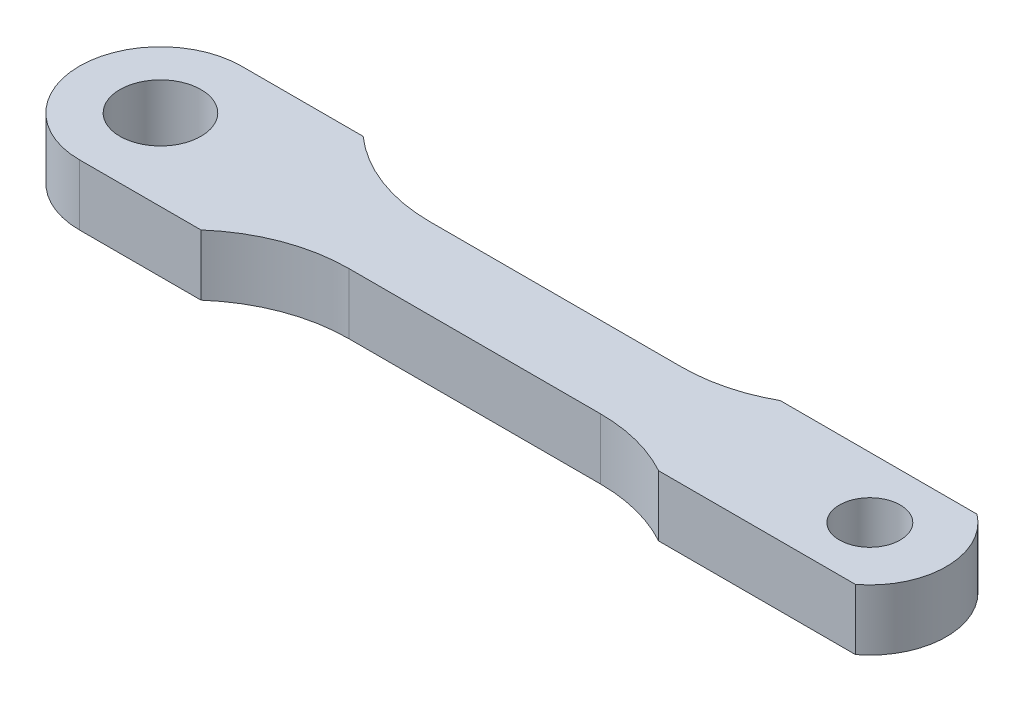
from build123d import *

# Parameters (mm, degrees)
SKETCH1_R           = 2
SKETCH1_R_2         = 1.5
BOSS_EXTRUDE1_DEPTH = 1.5


with BuildPart() as part:
    # Sketch1 → Boss-Extrude1 (new, symmetric)
    with BuildSketch(Plane(origin=(0, 0, 0), x_dir=(1, 0, 0), z_dir=(0, 1, 0))):
        with BuildLine():
            Line((6.208497378, -2), (-6.208497378, -2))
            ThreePointArc((-6.208497378, -2), (-9.036924503, -2.516685226), (-11.5, -4))
            Line((-11.5, -4), (-17.5, -4))
            ThreePointArc((-17.5, -4), (-21.5, 0), (-17.5, 4))
            Line((-17.5, 4), (-11.5, 4))
            ThreePointArc((-11.5, 4), (-9.036924503, 2.516685226), (-6.208497378, 2))
            Line((-6.208497378, 2), (6.208497378, 2))
            ThreePointArc((6.208497378, 2), (8.208497378, 2.254033308), (10.081480724, 3))
            Line((10.081480724, 3), (19.789473684, 3))
            ThreePointArc((19.789473684, 3), (21.273816338, 0), (19.789473684, -3))
            Line((19.789473684, -3), (10.081480724, -3))
            ThreePointArc((10.081480724, -3), (8.208497378, -2.254033308), (6.208497378, -2))
        make_face()
        with Locations(Location((-17.5, 0, 0), (0, 0, 270))):
            Circle(SKETCH1_R, mode=Mode.SUBTRACT)
        with Locations(Location((17.5, 0, 0), (0, 0, 270))):
            Circle(SKETCH1_R_2, mode=Mode.SUBTRACT)
    extrude(amount=BOSS_EXTRUDE1_DEPTH, both=True)


solid = part.part
